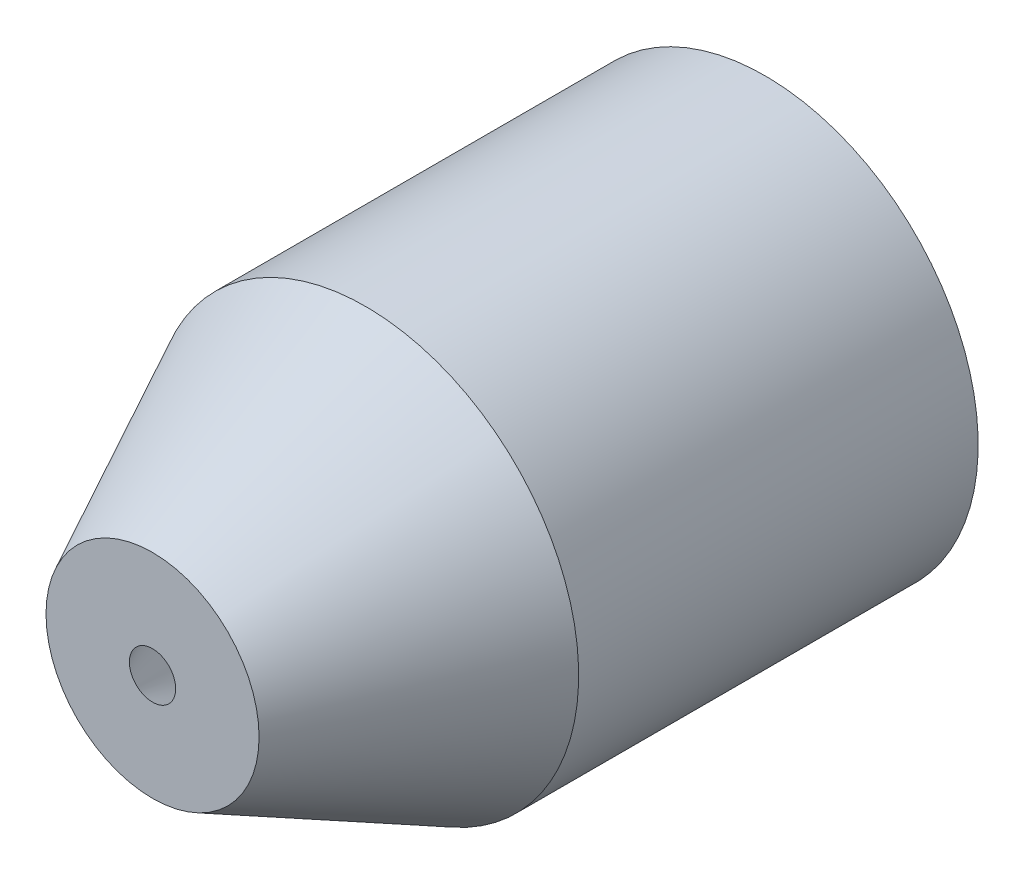
from build123d import *

# Parameters (mm, degrees)
SHELL1_T           = -2.8
SKETCH6_R          = 5.1
CUT_EXTRUDE4_DEPTH = 15


with BuildPart() as part:
    # Sketch1 → Revolve1 (revolve)
    with BuildSketch(Plane(origin=(0, 0, 0), x_dir=(1, 0, 0), z_dir=(0, 1, 0))):
        Polygon((0, 0), (-8, 0), (-8, -15), (-4, -23), (0, -23), align=None)
    revolve(axis=Axis((0, 0, -36.045977011), (0, 0, 1)))

    # Shell1
    shell1_openings = [part.faces().sort_by_distance(p)[0] for p in [
        (0, 0, 23),
    ]]
    offset(amount=SHELL1_T, openings=shell1_openings, kind=Kind.INTERSECTION)

    # Sketch6 → Cut-Extrude4 (cut)
    with BuildSketch(Plane(origin=(0, 0, 0), x_dir=(-1, 0, 0), z_dir=(0, 0, -1))):
        Circle(SKETCH6_R)
    extrude(amount=-CUT_EXTRUDE4_DEPTH, mode=Mode.SUBTRACT)


solid = part.part
